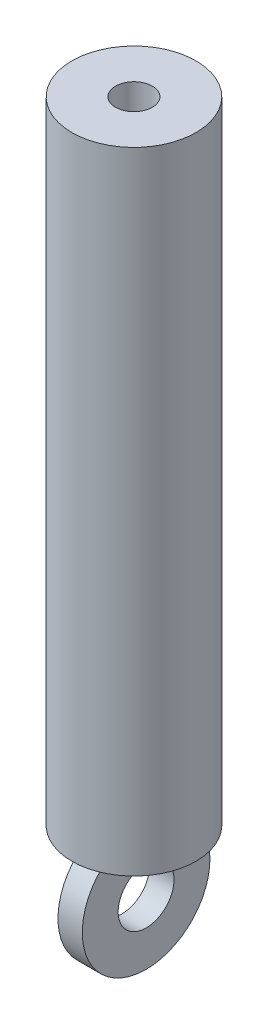
from build123d import *

# Parameters (mm, degrees)
EXTRUDE1_DEPTH      = 35.56
EXTRUDE1_DEPTH_BACK = 10.641310793
EXTRUDE1_START      = 1.27
SKETCH1_R           = 4.5466
SKETCH1_R_2         = 1.3462
SKETCH4_R           = 4.6736
SKETCH4_R_2         = 2.0447
EXTRUDE2_DEPTH      = 0.889


with BuildPart() as part:
    # Sketch1 → Extrude1 (new, two sides: drawn at the far end of the back side and taken through both)
    with BuildSketch(Plane(origin=(0, 0, 0), x_dir=(1, 0, 0), z_dir=(0, 1, 0)).offset(EXTRUDE1_START - EXTRUDE1_DEPTH_BACK)):
        with Locations(Location((0, 0, 0), (0, 0, 270))):
            Circle(SKETCH1_R)
        with Locations(Location((0, 0, 0), (0, 0, 270))):
            Circle(SKETCH1_R_2, mode=Mode.SUBTRACT)
    extrude(amount=EXTRUDE1_DEPTH + EXTRUDE1_DEPTH_BACK)


with BuildPart() as body_2:
    # Sketch4 → Extrude2 (new, symmetric)
    with BuildSketch(Plane(origin=(0, 0, 0), x_dir=(0, 0, -1), z_dir=(1, 0, 0))):
        with Locations((0, -13.3858)):
            Circle(SKETCH4_R)
        with Locations((0, -13.3858)):
            Circle(SKETCH4_R_2, mode=Mode.SUBTRACT)
    extrude(amount=EXTRUDE2_DEPTH, both=True)


solid = Compound([part.part, body_2.part])
